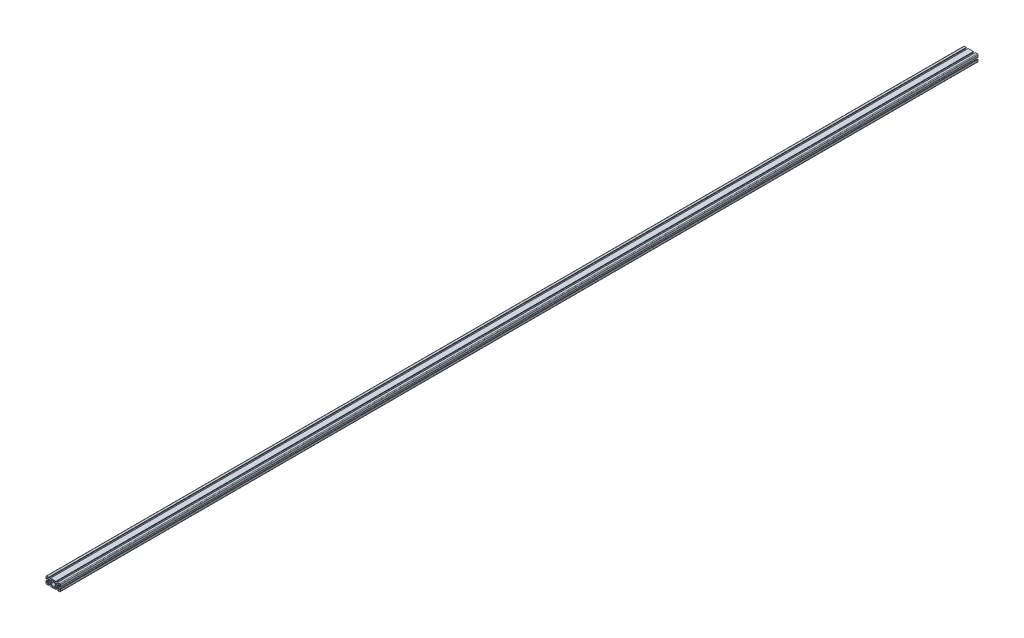
from build123d import *

# Parameters (mm, degrees)
BOSS_EXTRUDE1_DEPTH = 1280
BOSS_EXTRUDE2_DEPTH = 1280
FILLET1_R           = 0.75
FILLET2_R           = 1.25


with BuildPart() as part:
    # Sketch3 → Boss-Extrude1 (new, symmetric)
    with BuildSketch(Plane.XY):
        with BuildLine():
            Line((12.5, -10), (17.9, -10))
            ThreePointArc((17.9, -10), (19.38492424, -9.38492424), (20, -7.9))
            Line((20, -7.9), (20, -2.5))
            Line((20, -2.5), (18.213351365, -2.5))
            Line((18.213351365, -2.5), (18.213351365, -6.95))
            Line((18.213351365, -6.95), (13.6, -2.336648635))
            Line((13.6, -2.336648635), (13.6, 0))
            Line((13.6, 0), (12.15, 0))
            ThreePointArc((12.15, 0), (11.52027958, -1.52027958), (10, -2.15))
            Line((10, -2.15), (10, -3.6))
            Line((10, -3.6), (12.336648635, -3.6))
            Line((12.336648635, -3.6), (16.95, -8.213351365))
            Line((16.95, -8.213351365), (12.5, -8.213351365))
            Line((12.5, -8.213351365), (12.5, -10))
        make_face()
    extrude(amount=BOSS_EXTRUDE1_DEPTH, both=True)

    # Sketch4 → Boss-Extrude2 (add, symmetric)
    with BuildSketch(Plane.XY):
        with BuildLine():
            Line((10, -3.6), (7.663351365, -3.6))
            Line((7.663351365, -3.6), (3.05, -8.213351365))
            Line((3.05, -8.213351365), (7.5, -8.213351365))
            Line((7.5, -8.213351365), (7.5, -10))
            Line((7.5, -10), (0, -10))
            Line((0, -10), (0, -8.736648635))
            Line((0, -8.736648635), (6.4, -2.336648635))
            Line((6.4, -2.336648635), (6.4, 0))
            Line((6.4, 0), (7.85, 0))
            ThreePointArc((7.85, 0), (8.47972042, -1.52027958), (10, -2.15))
            Line((10, -2.15), (10, -3.6))
        make_face()
    extrude(amount=BOSS_EXTRUDE2_DEPTH, both=True)

    # Mirror1: part across plane


with BuildPart() as part_1:
    add(part.part)
    add(part.part.mirror(Plane(origin=(0, 0, 0), x_dir=(0, 0, 1), z_dir=(1, 0, 0))))

    # Mirror2: part across plane


with BuildPart() as part_2:
    add(part_1.part)
    add(part_1.part.mirror(Plane.ZX))

    # Fillet1
    fillet1_edges = [part_2.edges().sort_by_distance(p)[0] for p in [
        (18.213351365, 6.95, 0),
        (13.6, 2.336648635, 0),
        (12.336648635, 3.6, 0),
        (16.95, 8.213351365, 0),
        (3.05, 8.213351365, 0),
        (7.663351365, 3.6, 0),
        (-18.213351365, 6.95, 0),
        (-13.6, 2.336648635, 0),
        (-7.663351365, 3.6, 0),
        (-12.336648635, 3.6, 0),
        (-16.95, 8.213351365, 0),
        (-3.05, 8.213351365, 0),
        (16.95, -8.213351365, 0),
        (12.336648635, -3.6, 0),
        (13.6, -2.336648635, 0),
        (18.213351365, -6.95, 0),
        (3.05, -8.213351365, 0),
        (7.663351365, -3.6, 0),
        (-18.213351365, -6.95, 0),
        (-13.6, -2.336648635, 0),
        (-12.336648635, -3.6, 0),
        (-16.95, -8.213351365, 0),
        (-3.05, -8.213351365, 0),
        (-7.663351365, -3.6, 0),
    ]]
    fillet(fillet1_edges, radius=FILLET1_R)

    # Fillet2
    fillet2_edges = [part_2.edges().sort_by_distance(p)[0] for p in [
        (6.4, 2.336648635, 0),
        (0, 8.736648635, 0),
        (-6.4, 2.336648635, 0),
        (6.4, -2.336648635, 0),
        (-6.4, -2.336648635, 0),
        (0, -8.736648635, 0),
    ]]
    fillet(fillet2_edges, radius=FILLET2_R)


solid = part_2.part
